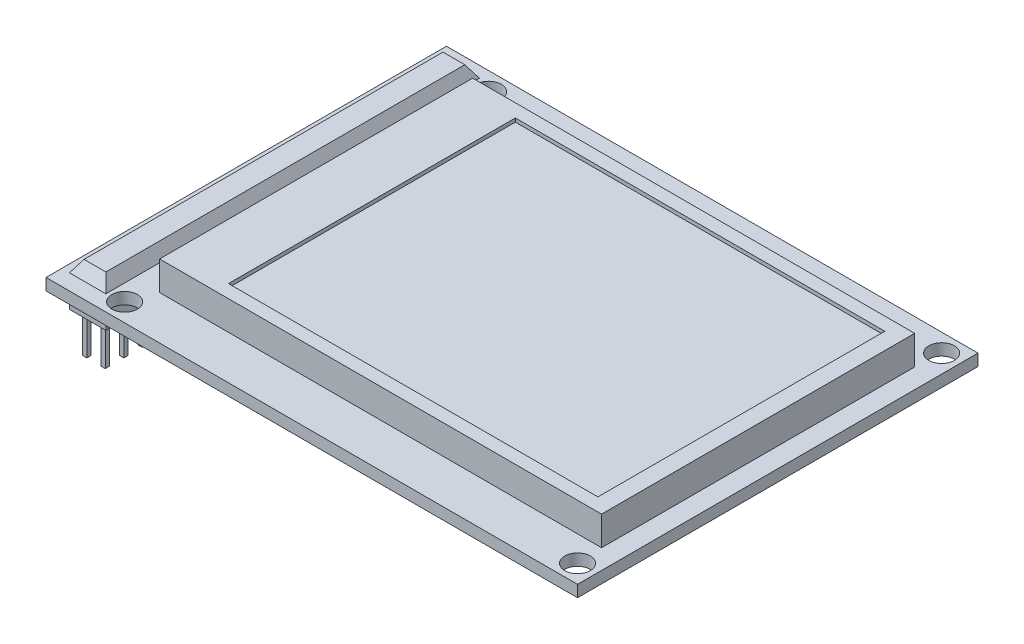
from build123d import *

# Parameters (mm, degrees)
SKETCH1_W                     = 73
SKETCH1_H                     = 55
BOSS_EXTRUDE1_DEPTH           = 1.6
SKETCH2_W                     = 60.7
SKETCH2_H                     = 43
BOSS_EXTRUDE2_DEPTH           = 4
SKETCH3_W                     = 5
SKETCH3_H                     = 51.3
BOSS_EXTRUDE3_DEPTH           = 2.75
SKETCH4_W                     = 0.6
SKETCH4_H                     = 0.6
BOSS_EXTRUDE4_DEPTH           = 5.5
SKETCH5_W                     = 16.5
SKETCH5_H                     = 29
BOSS_EXTRUDE5_DEPTH           = 3
SKETCH10_R                    = 1.75
CUT_EXTRUDE3_DEPTH            = 92.929443053
SKETCH6_W                     = 28.9
SKETCH6_H                     = 2.95
CUT_EXTRUDE1_DEPTH            = 30
SKETCH7_W                     = 5
SKETCH7_H                     = 51.3
BOSS_EXTRUDE6_DEPTH           = 1.6
BOSS_EXTRUDE6_TAPER           = 32
SKETCH8_W                     = 11
SKETCH8_H                     = 26
BOSS_EXTRUDE7_DEPTH           = 1.6
BOSS_EXTRUDE7_DRAFT           = 15
SKETCH8_W_2                   = 7
SKETCH8_H_2                   = 8
BOSS_EXTRUDE7_PROFILE_2_DEPTH = 1.6
BOSS_EXTRUDE7_PROFILE_2_DRAFT = 15
SKETCH9_W                     = 50.74
SKETCH9_H                     = 39.4
CUT_EXTRUDE2_DEPTH            = 0.5


with BuildPart() as part:
    # Sketch1 → Boss-Extrude1 (new body)
    with BuildSketch(Plane(origin=(0, 0, 0), x_dir=(1, 0, 0), z_dir=(0, 1, 0))):
        with Locations((36.5, 27.5)):
            Rectangle(SKETCH1_W, SKETCH1_H)
    extrude(amount=BOSS_EXTRUDE1_DEPTH)

    # Sketch2 → Boss-Extrude2 (add)
    with BuildSketch(Plane(origin=(0, 1.6, 0), x_dir=(1, 0, 0), z_dir=(0, 1, 0))):
        with Locations((39.95, 27.5)):
            Rectangle(SKETCH2_W, SKETCH2_H)
    extrude(amount=BOSS_EXTRUDE2_DEPTH)

    # Sketch3 → Boss-Extrude3 (add)
    with BuildSketch(Plane.XZ):
        with Locations((3.56, -27.81)):
            Rectangle(SKETCH3_W, SKETCH3_H)
    extrude(amount=BOSS_EXTRUDE3_DEPTH)

    # Sketch4 → Boss-Extrude4 (add)
    with BuildSketch(Plane.XZ.offset(2.75)):
        with Locations((2.23, -26.23)):
            Rectangle(SKETCH4_W, SKETCH4_H)
        with Locations((4.77, -26.23)):
            Rectangle(SKETCH4_W, SKETCH4_H)
        with Locations((2.23, -23.69)):
            Rectangle(SKETCH4_W, SKETCH4_H)
        with Locations((4.77, -23.69)):
            Rectangle(SKETCH4_W, SKETCH4_H)
        with Locations((2.23, -21.15)):
            Rectangle(SKETCH4_W, SKETCH4_H)
        with Locations((4.77, -21.15)):
            Rectangle(SKETCH4_W, SKETCH4_H)
        with Locations((2.23, -18.61)):
            Rectangle(SKETCH4_W, SKETCH4_H)
        with Locations((4.77, -18.61)):
            Rectangle(SKETCH4_W, SKETCH4_H)
        with Locations((2.23, -16.07)):
            Rectangle(SKETCH4_W, SKETCH4_H)
        with Locations((4.77, -16.07)):
            Rectangle(SKETCH4_W, SKETCH4_H)
        with Locations((2.23, -13.53)):
            Rectangle(SKETCH4_W, SKETCH4_H)
        with Locations((4.77, -13.53)):
            Rectangle(SKETCH4_W, SKETCH4_H)
        with Locations((2.23, -10.99)):
            Rectangle(SKETCH4_W, SKETCH4_H)
        with Locations((4.77, -10.99)):
            Rectangle(SKETCH4_W, SKETCH4_H)
        with Locations((2.23, -8.45)):
            Rectangle(SKETCH4_W, SKETCH4_H)
        with Locations((4.77, -8.45)):
            Rectangle(SKETCH4_W, SKETCH4_H)
        with Locations((2.23, -5.91)):
            Rectangle(SKETCH4_W, SKETCH4_H)
        with Locations((4.77, -5.91)):
            Rectangle(SKETCH4_W, SKETCH4_H)
        with Locations((2.23, -3.37)):
            Rectangle(SKETCH4_W, SKETCH4_H)
        with Locations((4.77, -3.37)):
            Rectangle(SKETCH4_W, SKETCH4_H)
        with Locations((4.77, -51.63)):
            Rectangle(SKETCH4_W, SKETCH4_H)
        with Locations((2.23, -51.63)):
            Rectangle(SKETCH4_W, SKETCH4_H)
        with Locations((4.77, -49.09)):
            Rectangle(SKETCH4_W, SKETCH4_H)
        with Locations((2.23, -49.09)):
            Rectangle(SKETCH4_W, SKETCH4_H)
        with Locations((4.77, -46.55)):
            Rectangle(SKETCH4_W, SKETCH4_H)
        with Locations((2.23, -46.55)):
            Rectangle(SKETCH4_W, SKETCH4_H)
        with Locations((4.77, -44.01)):
            Rectangle(SKETCH4_W, SKETCH4_H)
        with Locations((2.23, -44.01)):
            Rectangle(SKETCH4_W, SKETCH4_H)
        with Locations((4.77, -41.47)):
            Rectangle(SKETCH4_W, SKETCH4_H)
        with Locations((2.23, -41.47)):
            Rectangle(SKETCH4_W, SKETCH4_H)
        with Locations((4.77, -38.93)):
            Rectangle(SKETCH4_W, SKETCH4_H)
        with Locations((2.23, -38.93)):
            Rectangle(SKETCH4_W, SKETCH4_H)
        with Locations((4.77, -36.39)):
            Rectangle(SKETCH4_W, SKETCH4_H)
        with Locations((2.23, -36.39)):
            Rectangle(SKETCH4_W, SKETCH4_H)
        with Locations((4.77, -33.85)):
            Rectangle(SKETCH4_W, SKETCH4_H)
        with Locations((2.23, -33.85)):
            Rectangle(SKETCH4_W, SKETCH4_H)
        with Locations((4.77, -31.31)):
            Rectangle(SKETCH4_W, SKETCH4_H)
        with Locations((2.23, -31.31)):
            Rectangle(SKETCH4_W, SKETCH4_H)
        with Locations((4.77, -28.77)):
            Rectangle(SKETCH4_W, SKETCH4_H)
        with Locations((2.23, -28.77)):
            Rectangle(SKETCH4_W, SKETCH4_H)
    extrude(amount=BOSS_EXTRUDE4_DEPTH)

    # Sketch5 → Boss-Extrude5 (add)
    with BuildSketch(Plane.XZ):
        with Locations((58.25, -27.5)):
            Rectangle(SKETCH5_W, SKETCH5_H)
    extrude(amount=BOSS_EXTRUDE5_DEPTH)

    # Sketch10 → Cut-Extrude3 (cut, through all)
    with BuildSketch(Plane(origin=(0, 1.6, 0), x_dir=(1, 0, 0), z_dir=(0, 1, 0))):
        with Locations((70.5, 52.5)):
            Circle(SKETCH10_R)
        with Locations((70.5, 2.5)):
            Circle(SKETCH10_R)
        with Locations((8.3, 2.5)):
            Circle(SKETCH10_R)
        with Locations((8.3, 52.5)):
            Circle(SKETCH10_R)
    extrude(amount=-CUT_EXTRUDE3_DEPTH, mode=Mode.SUBTRACT)

    # Sketch6 → Cut-Extrude1 (cut)
    with BuildSketch(Plane(origin=(73, 0, 0), x_dir=(0, 0, -1), z_dir=(1, 0, 0))):
        with Locations((27.5, -1.475)):
            Rectangle(SKETCH6_W, SKETCH6_H)
    extrude(amount=-CUT_EXTRUDE1_DEPTH, mode=Mode.SUBTRACT)

    # Sketch7 → Boss-Extrude6 (add)
    with BuildSketch(Plane(origin=(0, 1.6, 0), x_dir=(1, 0, 0), z_dir=(0, 1, 0))):
        with Locations((3.56, 27.81)):
            Rectangle(SKETCH7_W, SKETCH7_H)
    extrude(amount=BOSS_EXTRUDE6_DEPTH, taper=BOSS_EXTRUDE6_TAPER)


with BuildPart() as boss_extrude7_tool:
    # Sketch8 → Boss-Extrude7 (with draft: the straight prism first)
    with BuildSketch(Plane.XZ):
        with Locations((39.5, -27)):
            Rectangle(SKETCH8_W, SKETCH8_H)
    extrude(amount=BOSS_EXTRUDE7_DEPTH)
    # Boss-Extrude7: the draft: its side faces are tilted about the plane it starts from
    boss_extrude7_sides = [boss_extrude7_tool.faces().sort_by_distance(p)[0] for p in [
        (45, -0.8, -27),
        (39.5, -0.8, -14),
        (34, -0.8, -27),
        (39.5, -0.8, -40),
    ]]
    draft(boss_extrude7_sides, Plane.XZ, BOSS_EXTRUDE7_DRAFT)


with BuildPart() as part_1:
    add(part.part)

    # Boss-Extrude7: add boss_extrude7_tool
    add(boss_extrude7_tool.part)


with BuildPart() as boss_extrude7_profile_2_tool:
    # Sketch8 → Boss-Extrude7 profile 2 (with draft: the straight prism first)
    with BuildSketch(Plane.XZ):
        with Locations((18.5, -40)):
            Rectangle(SKETCH8_W_2, SKETCH8_H_2)
    extrude(amount=BOSS_EXTRUDE7_PROFILE_2_DEPTH)
    # Boss-Extrude7 profile 2: the draft: its side faces are tilted about the plane it starts from
    boss_extrude7_profile_2_sides = [boss_extrude7_profile_2_tool.faces().sort_by_distance(p)[0] for p in [
        (22, -0.8, -40),
        (18.5, -0.8, -36),
        (15, -0.8, -40),
        (18.5, -0.8, -44),
    ]]
    draft(boss_extrude7_profile_2_sides, Plane.XZ, BOSS_EXTRUDE7_PROFILE_2_DRAFT)


with BuildPart() as part_2:
    add(part_1.part)

    # Boss-Extrude7 profile 2: add boss_extrude7_profile_2_tool
    add(boss_extrude7_profile_2_tool.part)

    # Sketch9 → Cut-Extrude2 (cut)
    with BuildSketch(Plane(origin=(0, 5.6, 0), x_dir=(1, 0, 0), z_dir=(0, 1, 0))):
        with Locations((42.63, 27.5)):
            Rectangle(SKETCH9_W, SKETCH9_H)
    extrude(amount=-CUT_EXTRUDE2_DEPTH, mode=Mode.SUBTRACT)


solid = part_2.part
